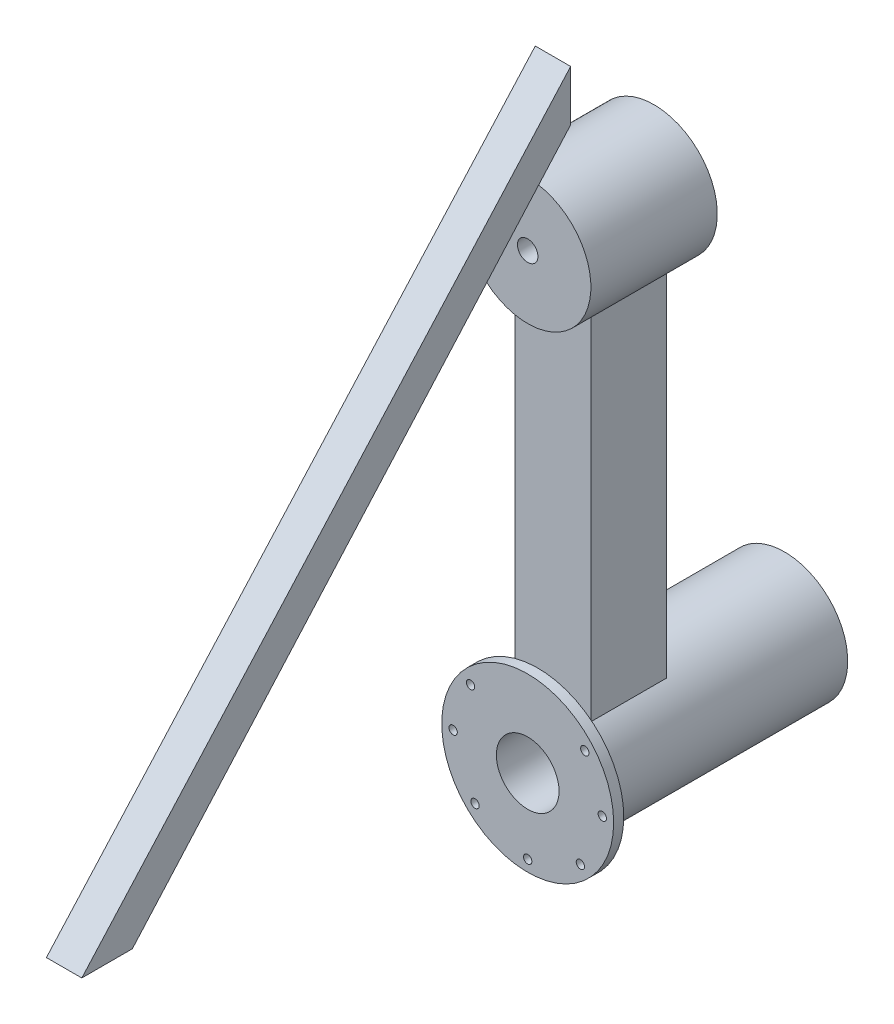
from build123d import *

# Parameters (mm, degrees)
CROQUIS1_R                    = 25
SALIENTE_EXTRUIR1_DEPTH       = 270
CROQUIS2_W                    = 30
CROQUIS2_H                    = 30
SALIENTE_EXTRUIR13_DEPTH      = 150
SALIENTE_EXTRUIR14_DEPTH      = 10
SALIENTE_EXTRUIR14_DEPTH_BACK = 40
CROQUIS14_R                   = 25
SALIENTE_EXTRUIR15_DEPTH      = 7
SALIENTE_EXTRUIR15_DEPTH_BACK = 7
SALIENTE_EXTRUIR16_START      = 50
CROQUIS17_R                   = 25
SALIENTE_EXTRUIR16_DEPTH      = 50
CROQUIS20_R                   = 3.95
SALIENTE_EXTRUIR18_DEPTH      = 6
CROQUIS21_R                   = 2.05
CORTAR_EXTRUIR2_DEPTH         = 10
CROQUIS22_W                   = 20
CROQUIS22_H                   = 20
CORTAR_EXTRUIR3_DEPTH         = 20
SALIENTE_EXTRUIR19_DEPTH      = 30
CROQUIS28_R                   = 26.403024508
CORTAR_EXTRUIR4_DEPTH         = 218.4
CROQUIS29_R                   = 34.264555867
CORTAR_EXTRUIR5_DEPTH         = 218.4
CROQUIS30_R                   = 12.4
CORTAR_EXTRUIR6_DEPTH         = 30.1
CROQUIS31_R                   = 4.05
CORTAR_EXTRUIR7_DEPTH         = 60
SALIENTE_EXTRUIR20_START      = -4
CROQUIS32_R                   = 34
CROQUIS32_R_2                 = 25
CROQUIS32_R_3                 = 1.65
SALIENTE_EXTRUIR20_DEPTH      = 4


with BuildPart() as part:
    # Croquis1 → Saliente-Extruir1 (new body)
    with BuildSketch(Plane.XY):
        Circle(CROQUIS1_R)
    extrude(amount=SALIENTE_EXTRUIR1_DEPTH)

    # Croquis2 → Saliente-Extruir13 (add)
    with BuildSketch(Plane(origin=(0, 0, 0), x_dir=(1, 0, 0), z_dir=(0, 1, 0))):
        with Locations((-0.05, -26.604607898)):
            Rectangle(CROQUIS2_W, CROQUIS2_H)
    extrude(amount=SALIENTE_EXTRUIR13_DEPTH)

    # Croquis17 → Saliente-Extruir16 (add)
    with BuildSketch(Plane(origin=(0, 0, 0), x_dir=(-1, 0, 0), z_dir=(0, 0, -1)).offset(SALIENTE_EXTRUIR16_START)):
        Circle(CROQUIS17_R)
    extrude(amount=-SALIENTE_EXTRUIR16_DEPTH)

    # Croquis20 → Saliente-Extruir18 (add)
    with BuildSketch(Plane(origin=(0, 0, -50), x_dir=(-1, 0, 0), z_dir=(0, 0, -1))):
        Circle(CROQUIS20_R)
    extrude(amount=SALIENTE_EXTRUIR18_DEPTH)

    # Croquis21 → Cortar-Extruir2 (cut)
    with BuildSketch(Plane.XY.offset(270)):
        Circle(CROQUIS21_R)
    extrude(amount=-CORTAR_EXTRUIR2_DEPTH, mode=Mode.SUBTRACT)

    # Croquis22 → Cortar-Extruir3 (cut)
    with BuildSketch(Plane(origin=(0, -25, 0), x_dir=(-1, 0, 0), z_dir=(0, -1, 0))):
        with Locations((0, 24.197696051)):
            Rectangle(CROQUIS22_W, CROQUIS22_H)
    extrude(amount=-CORTAR_EXTRUIR3_DEPTH, mode=Mode.SUBTRACT)



with BuildPart() as body_2:
    # Croquis14 → Saliente-Extruir14 (new, two sides: drawn at the far end of the back side and taken through both)
    with BuildSketch(Plane(origin=(0, 0, 11.604607898), x_dir=(-1, 0, 0), z_dir=(0, 0, -1)).offset(-SALIENTE_EXTRUIR14_DEPTH_BACK)):
        with Locations((0, 179)):
            Circle(CROQUIS14_R)
    extrude(amount=SALIENTE_EXTRUIR14_DEPTH + SALIENTE_EXTRUIR14_DEPTH_BACK)


with BuildPart() as body_3:
    # Croquis15 → Saliente-Extruir15 (new, two sides: drawn at the far end of the back side and taken through both)
    with BuildSketch(Plane(origin=(0, 0, 0), x_dir=(0, 0, -1), z_dir=(1, 0, 0)).offset(-SALIENTE_EXTRUIR15_DEPTH_BACK)):
        Polygon((-41.604607898, 240.604607898), (-235, 25), (-215, 25), (-41.604607898, 220.604607898), align=None)
    extrude(amount=SALIENTE_EXTRUIR15_DEPTH + SALIENTE_EXTRUIR15_DEPTH_BACK)


with BuildPart() as part_1:
    add(part.part)

    add(body_2.part)  # Saliente-Extruir19 merges body 2
    # Croquis27 → Saliente-Extruir19 (add)
    with BuildSketch(Plane(origin=(0, 0, 11.604607898), x_dir=(-1, 0, 0), z_dir=(0, 0, -1))):
        with BuildLine():
            Line((-14.95, 150), (-14.95, 158.962597474))
            ThreePointArc((-14.95, 158.962597474), (0.06250011, 154.000078125), (15.05, 159.03759784))
            Line((15.05, 159.03759784), (15.05, 150))
            Line((15.05, 150), (-14.95, 150))
        make_face()
    extrude(amount=-SALIENTE_EXTRUIR19_DEPTH)

    # Croquis28 → Cortar-Extruir4 (cut)
    with BuildSketch(Plane.XY.offset(270)):
        Circle(CROQUIS28_R)
    extrude(amount=-CORTAR_EXTRUIR4_DEPTH, mode=Mode.SUBTRACT)

    # Croquis29 → Cortar-Extruir5 (cut)
    with BuildSketch(Plane(origin=(0, 0, -50), x_dir=(-1, 0, 0), z_dir=(0, 0, -1))):
        Circle(CROQUIS29_R)
    extrude(amount=CORTAR_EXTRUIR5_DEPTH, mode=Mode.SUBTRACT)

    # Croquis30 → Cortar-Extruir6 (cut)
    with BuildSketch(Plane.XY.offset(51.6)):
        Circle(CROQUIS30_R)
    extrude(amount=-CORTAR_EXTRUIR6_DEPTH, mode=Mode.SUBTRACT)

    # Croquis31 → Cortar-Extruir7 (cut)
    with BuildSketch(Plane(origin=(0, 0, 1.604607898), x_dir=(-1, 0, 0), z_dir=(0, 0, -1))):
        with Locations((0, 179)):
            Circle(CROQUIS31_R)
    extrude(amount=-CORTAR_EXTRUIR7_DEPTH, mode=Mode.SUBTRACT)

    # Croquis32 → Saliente-Extruir20 (add)
    with BuildSketch(Plane.XY.offset(51.6).offset(SALIENTE_EXTRUIR20_START)):
        Circle(CROQUIS32_R)
        with Locations(Location((0, 0, 0), (0, 0, 180))):
            Circle(CROQUIS32_R_2, mode=Mode.SUBTRACT)
        with Locations((-22.598311072, 18.962234486)):
            Circle(CROQUIS32_R_3, mode=Mode.SUBTRACT)
        with Locations((-29.5, 0)):
            Circle(CROQUIS32_R_3, mode=Mode.SUBTRACT)
        with Locations((-20.839445312, -20.839445312)):
            Circle(CROQUIS32_R_3, mode=Mode.SUBTRACT)
        with Locations((0, -29.5)):
            Circle(CROQUIS32_R_3, mode=Mode.SUBTRACT)
        with Locations(Location((20.839445312, -20.839445312, 0), (0, 0, 180))):
            Circle(CROQUIS32_R_3, mode=Mode.SUBTRACT)
        with Locations(Location((29.5, 0, 0), (0, 0, 180))):
            Circle(CROQUIS32_R_3, mode=Mode.SUBTRACT)
        with Locations(Location((22.598311072, 18.962234486, 0), (0, 0, 180))):
            Circle(CROQUIS32_R_3, mode=Mode.SUBTRACT)
    extrude(amount=SALIENTE_EXTRUIR20_DEPTH)


solid = Compound([body_3.part, part_1.part])
